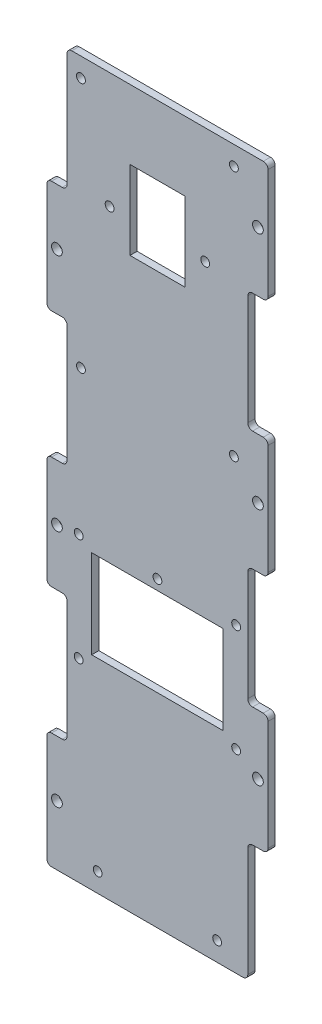
from build123d import *

# Parameters (mm, degrees)
SKETCH1_W           = 92.6
SKETCH1_H           = 300
BOSS_EXTRUDE1_DEPTH = 3
SKETCH2_R           = 2.25
SKETCH2_W           = 8.48
SKETCH2_H           = 51.5
SKETCH2_H_2         = 50
SKETCH2_H_3         = 53
CUT_EXTRUDE2_DEPTH  = 10
FILLET1_R           = 2
SKETCH3_R           = 1.85
CUT_EXTRUDE3_DEPTH  = 10
SKETCH4_R           = 1.85
SKETCH4_W           = 55
SKETCH4_H           = 37
CUT_EXTRUDE4_DEPTH  = 5
SKETCH5_R           = 1.85
SKETCH5_W           = 23
SKETCH5_H           = 33
CUT_EXTRUDE5_DEPTH  = 5


with BuildPart() as part:
    # Sketch1 → Boss-Extrude1 (new body)
    with BuildSketch(Plane.XY):
        Rectangle(SKETCH1_W, SKETCH1_H)
    extrude(amount=BOSS_EXTRUDE1_DEPTH)

    # Sketch2 → Cut-Extrude2 (cut)
    with BuildSketch(Plane.XY):
        with Locations((-42.06, 75)):
            Circle(SKETCH2_R)
        with Locations((42.06, 125)):
            Circle(SKETCH2_R)
        with Locations((42.06, 25)):
            Circle(SKETCH2_R)
        with Locations((42.06, -75)):
            Circle(SKETCH2_R)
        with Locations((-42.06, -25)):
            Circle(SKETCH2_R)
        with Locations((-42.06, -125)):
            Circle(SKETCH2_R)
        with Locations((-42.06, 124.25)):
            Rectangle(SKETCH2_W, SKETCH2_H)
        with Locations((42.06, 75)):
            Rectangle(SKETCH2_W, SKETCH2_H_2)
        with Locations((42.06, -25)):
            Rectangle(SKETCH2_W, SKETCH2_H_2)
        with Locations((-42.06, 25)):
            Rectangle(SKETCH2_W, SKETCH2_H_3)
        with Locations((-42.06, -75)):
            Rectangle(SKETCH2_W, SKETCH2_H_3)
        with Locations((42.06, -125)):
            Rectangle(SKETCH2_W, SKETCH2_H_2)
    extrude(amount=CUT_EXTRUDE2_DEPTH, mode=Mode.SUBTRACT)

    # Fillet1
    fillet1_edges = [part.edges().sort_by_distance(p)[0] for p in [
        (46.3, -100, 1.5),
        (37.82, -100, 1.5),
        (37.82, -150, 1.5),
        (46.3, 50, 1.5),
        (46.3, 100, 1.5),
        (37.82, 100, 1.5),
        (37.82, 50, 1.5),
        (-46.3, -48.5, 1.5),
        (-46.3, -101.5, 1.5),
        (-37.82, -101.5, 1.5),
        (-37.82, -48.5, 1.5),
        (37.82, 0, 1.5),
        (37.82, -50, 1.5),
        (46.3, -50, 1.5),
        (46.3, 0, 1.5),
        (46.3, 150, 1.5),
        (-46.3, 51.5, 1.5),
        (-46.3, -150, 1.5),
        (-46.3, -1.5, 1.5),
        (-37.82, -1.5, 1.5),
        (-37.82, 51.5, 1.5),
        (-46.3, 98.5, 1.5),
        (-37.82, 98.5, 1.5),
        (-37.82, 150, 1.5),
    ]]
    fillet(fillet1_edges, radius=FILLET1_R)

    # Sketch3 → Cut-Extrude3 (cut)
    with BuildSketch(Plane(origin=(0, 0, 0), x_dir=(-1, 0, 0), z_dir=(0, 0, -1))):
        with Locations((-25, -142)):
            Circle(SKETCH3_R)
        with Locations((25, -142)):
            Circle(SKETCH3_R)
        with Locations((-32, 142)):
            Circle(SKETCH3_R)
        with Locations((32, 142)):
            Circle(SKETCH3_R)
    extrude(amount=-CUT_EXTRUDE3_DEPTH, mode=Mode.SUBTRACT)

    # Sketch4 → Cut-Extrude4 (cut)
    with BuildSketch(Plane(origin=(0, 0, 0), x_dir=(-1, 0, 0), z_dir=(0, 0, -1))):
        with Locations((-32.95, -23.767949192)):
            Circle(SKETCH4_R)
        with Locations((0, -23.5)):
            Circle(SKETCH4_R)
        with Locations((32.95, -23.767949192)):
            Circle(SKETCH4_R)
        with Locations((32.95, -68.732050808)):
            Circle(SKETCH4_R)
        with Locations((-32.95, -68.732050808)):
            Circle(SKETCH4_R)
        with Locations((0, -46.25)):
            Rectangle(SKETCH4_W, SKETCH4_H)
    extrude(amount=-CUT_EXTRUDE4_DEPTH, mode=Mode.SUBTRACT)

    # Sketch5 → Cut-Extrude5 (cut)
    with BuildSketch(Plane(origin=(0, 0, 0), x_dir=(-1, 0, 0), z_dir=(0, 0, -1))):
        with Locations((32, 37)):
            Circle(SKETCH5_R)
        with Locations((-32, 37)):
            Circle(SKETCH5_R)
        with Locations((-20, 101.5)):
            Circle(SKETCH5_R)
        with Locations((20, 101.5)):
            Circle(SKETCH5_R)
        with Locations((0, 104.5)):
            Rectangle(SKETCH5_W, SKETCH5_H)
    extrude(amount=-CUT_EXTRUDE5_DEPTH, mode=Mode.SUBTRACT)


solid = part.part
